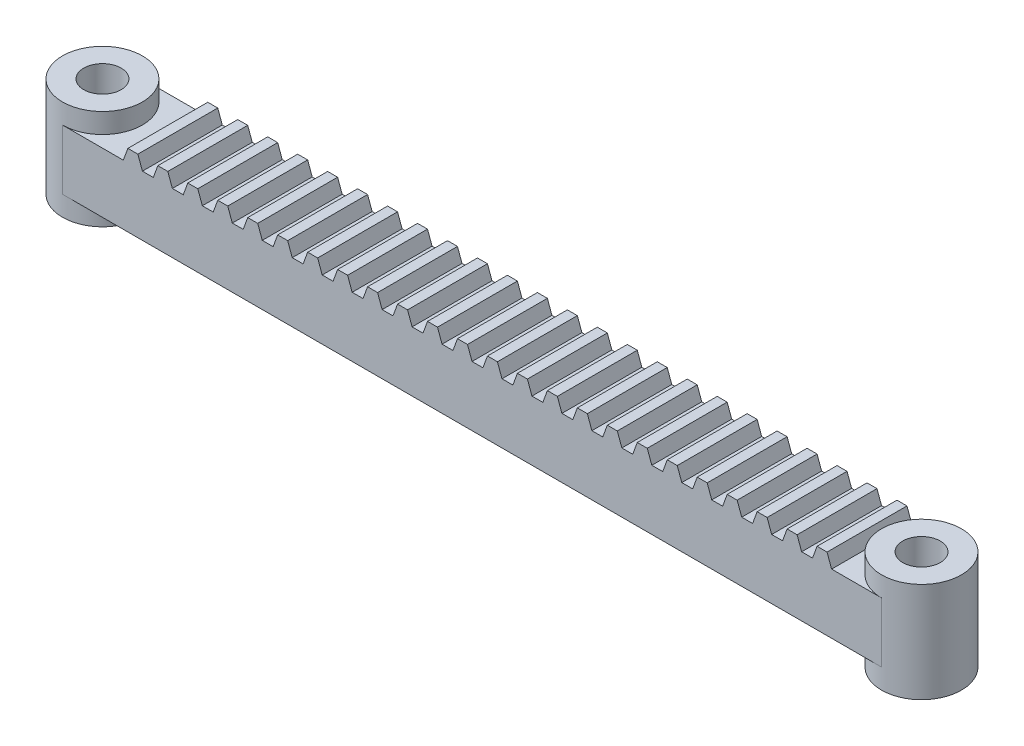
from build123d import *

# Parameters (mm, degrees)
BOSS_EXTRUDE1_DEPTH = 152.4
SKETCH1_4_R         = 203.2
SKETCH1_4_R_2       = 95.25
BOSS_EXTRUDE2_DEPTH = 254
BOSS_EXTRUDE3_DEPTH = 406.4
LPATTERN1_COUNT     = 24
LPATTERN1_PITCH     = 152.4


with BuildPart() as part:
    # Sketch1 → Boss-Extrude1 (new, symmetric)
    with BuildSketch(Plane(origin=(0, 0, 0), x_dir=(1, 0, 0), z_dir=(0, 1, 0))):
        with BuildLine():
            ThreePointArc((-1879.6, 0), (-1939.115902063, -143.684097937), (-2082.8, -203.2))
            Line((-2082.8, -203.2), (2082.8, -203.2))
            ThreePointArc((2082.8, -203.2), (1879.6, 0), (2082.8, 203.2))
            Line((2082.8, 203.2), (-2082.8, 203.2))
            ThreePointArc((-2082.8, 203.2), (-1939.115902063, 143.684097937), (-1879.6, 0))
        make_face()
    extrude(amount=BOSS_EXTRUDE1_DEPTH, both=True)

    # Sketch1<4> → Boss-Extrude2 (add, symmetric)
    # profile 1 of 2: a face of its own
    with BuildSketch(Plane(origin=(0, 0, 0), x_dir=(1, 0, 0), z_dir=(0, 1, 0))):
        with Locations(Location((-2082.8, 0, 0), (0, 0, 270))):
            Circle(SKETCH1_4_R)
        with Locations(Location((-2082.8, 0, 0), (0, 0, 270))):
            Circle(SKETCH1_4_R_2, mode=Mode.SUBTRACT)
    # profile 2 of 2: a face of its own
    with BuildSketch(Plane(origin=(0, 0, 0), x_dir=(1, 0, 0), z_dir=(0, 1, 0))):
        with Locations(Location((2082.8, 0, 0), (0, 0, 270))):
            Circle(SKETCH1_4_R)
        with Locations(Location((2082.8, 0, 0), (0, 0, 270))):
            Circle(SKETCH1_4_R_2, mode=Mode.SUBTRACT)
    extrude(amount=BOSS_EXTRUDE2_DEPTH, both=True)

    # Sketch2 → Boss-Extrude3 (add)
    with BuildSketch(Plane.XY.offset(203.2)):
        Polygon((1828.8, 152.4), (1805.687890124, 215.9), (1754.887890124, 215.9), (1731.775780248, 152.4), align=None)
    boss_extrude3 = extrude(amount=-BOSS_EXTRUDE3_DEPTH)

    # LPattern1: Boss-Extrude3 ×24
    with Locations(*[(-i * LPATTERN1_PITCH, 0, 0) for i in range(1, LPATTERN1_COUNT)]):
        add(boss_extrude3)


solid = part.part
